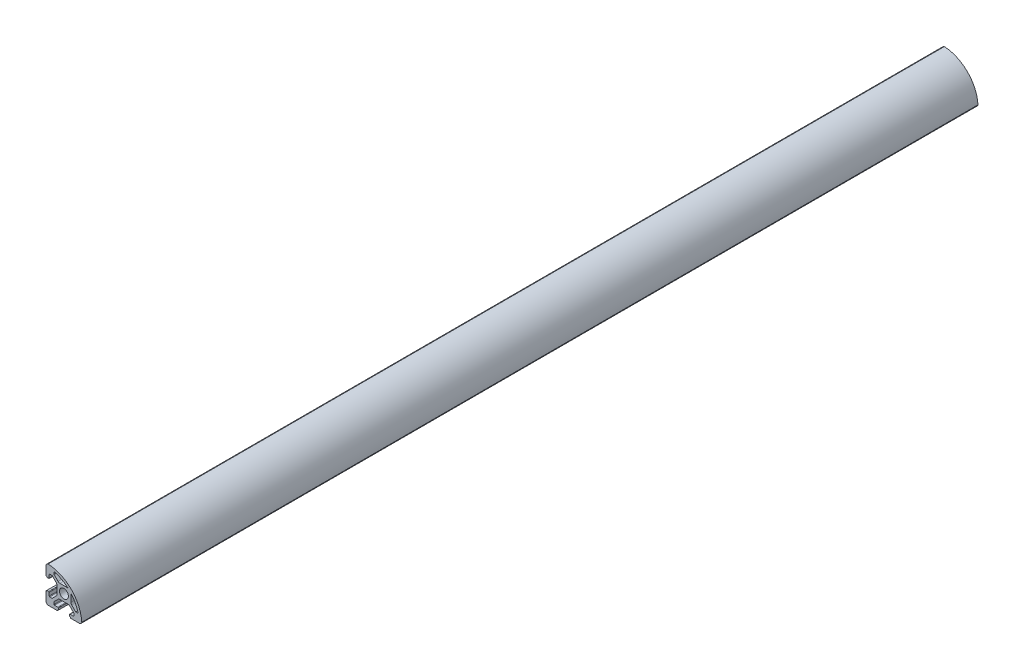
from build123d import *

# Parameters (mm, degrees)
SKETCH_1_R      = 2.5
EXTRUDE_1_DEPTH = 500


with BuildPart() as part:
    # 草图1 → 凸台-拉伸1 (new body)
    with BuildSketch(Plane.XY):
        with BuildLine():
            ThreePointArc((-8.944458369, 9.930115847), (-9.792033903, 9.405190523), (-10.123344197, 8.464890373))
            Line((-10.123344197, 8.464890373), (-10.123344197, 3.564890373))
            Line((-10.123344197, 3.564890373), (-9.823344197, 3.564890373))
            ThreePointArc((-9.823344197, 3.564890373), (-9.681922841, 3.50631173), (-9.623344197, 3.364890373))
            Line((-9.623344197, 3.364890373), (-9.623344197, 3.064890373))
            Line((-9.623344197, 3.064890373), (-8.623344197, 3.064890373))
            ThreePointArc((-8.623344197, 3.064890373), (-8.411212162, 3.152758339), (-8.323344197, 3.364890373))
            Line((-8.323344197, 3.364890373), (-8.323344197, 5.164890373))
            ThreePointArc((-8.323344197, 5.164890373), (-8.235476231, 5.377022408), (-8.023344197, 5.464890373))
            Line((-8.023344197, 5.464890373), (-6.683344197, 5.464890373))
            Line((-6.683344197, 5.464890373), (-4.462684025, 3.244230202))
            ThreePointArc((-4.462684025, 3.244230202), (-4.137524898, 2.757595178), (-4.023344197, 2.18357003))
            Line((-4.023344197, 2.18357003), (-4.023344197, -2.253789283))
            ThreePointArc((-4.023344197, -2.253789283), (-4.137524898, -2.827814432), (-4.462684025, -3.314449455))
            Line((-4.462684025, -3.314449455), (-6.683344197, -5.535109627))
            Line((-6.683344197, -5.535109627), (-8.023344197, -5.535109627))
            ThreePointArc((-8.023344197, -5.535109627), (-8.235476231, -5.447241661), (-8.323344197, -5.235109627))
            Line((-8.323344197, -5.235109627), (-8.323344197, -3.435109627))
            ThreePointArc((-8.323344197, -3.435109627), (-8.411212162, -3.222977592), (-8.623344197, -3.135109627))
            Line((-8.623344197, -3.135109627), (-9.623344197, -3.135109627))
            Line((-9.623344197, -3.135109627), (-9.623344197, -3.435109627))
            ThreePointArc((-9.623344197, -3.435109627), (-9.681922841, -3.576530983), (-9.823344197, -3.635109627))
            Line((-9.823344197, -3.635109627), (-10.123344197, -3.635109627))
            Line((-10.123344197, -3.635109627), (-10.123344197, -8.535109627))
            ThreePointArc((-10.123344197, -8.535109627), (-9.684004369, -9.595769798), (-8.623344197, -10.035109627))
            Line((-8.623344197, -10.035109627), (-3.723344197, -10.035109627))
            Line((-3.723344197, -10.035109627), (-3.723344197, -9.735109627))
            ThreePointArc((-3.723344197, -9.735109627), (-3.664765553, -9.59368827), (-3.523344197, -9.535109627))
            Line((-3.523344197, -9.535109627), (-3.223344197, -9.535109627))
            Line((-3.223344197, -9.535109627), (-3.223344197, -8.535109627))
            ThreePointArc((-3.223344197, -8.535109627), (-3.311212162, -8.322977592), (-3.523344197, -8.235109627))
            Line((-3.523344197, -8.235109627), (-5.323344197, -8.235109627))
            ThreePointArc((-5.323344197, -8.235109627), (-5.535476231, -8.147241661), (-5.623344197, -7.935109627))
            Line((-5.623344197, -7.935109627), (-5.623344197, -6.595109627))
            Line((-5.623344197, -6.595109627), (-3.402684025, -4.374449455))
            ThreePointArc((-3.402684025, -4.374449455), (-2.916049002, -4.049290328), (-2.342023853, -3.935109627))
            Line((-2.342023853, -3.935109627), (2.09533546, -3.935109627))
            ThreePointArc((2.09533546, -3.935109627), (2.669360608, -4.049290328), (3.155995631, -4.374449455))
            Line((3.155995631, -4.374449455), (5.376655803, -6.595109627))
            Line((5.376655803, -6.595109627), (5.376655803, -7.935109627))
            ThreePointArc((5.376655803, -7.935109627), (5.288787838, -8.147241661), (5.076655803, -8.235109627))
            Line((5.076655803, -8.235109627), (3.276655803, -8.235109627))
            ThreePointArc((3.276655803, -8.235109627), (3.064523769, -8.322977592), (2.976655803, -8.535109627))
            Line((2.976655803, -8.535109627), (2.976655803, -9.535109627))
            Line((2.976655803, -9.535109627), (3.276655803, -9.535109627))
            ThreePointArc((3.276655803, -9.535109627), (3.418077159, -9.59368827), (3.476655803, -9.735109627))
            Line((3.476655803, -9.735109627), (3.476655803, -10.035109627))
            Line((3.476655803, -10.035109627), (8.376655803, -10.035109627))
            ThreePointArc((8.376655803, -10.035109627), (9.316955952, -9.703799333), (9.841881277, -8.856223799))
            ThreePointArc((9.841881277, -8.856223799), (4.018791427, 4.107025997), (-8.944458369, 9.930115847))
        make_face()
        with BuildLine():
            ThreePointArc((7.820216628, -5.531930203), (7.798494154, -5.534313715), (7.776655803, -5.535109627))
            Line((7.776655803, -5.535109627), (6.436655803, -5.535109627))
            Line((6.436655803, -5.535109627), (4.215995631, -3.314449455))
            ThreePointArc((4.215995631, -3.314449455), (3.890836504, -2.827814432), (3.776655803, -2.253789283))
            Line((3.776655803, -2.253789283), (3.776655803, 2.173084343))
            ThreePointArc((3.776655803, 2.173084343), (6.257892136, -1.4383023), (7.820216628, -5.531930203))
        make_face(mode=Mode.SUBTRACT)
        with BuildLine():
            ThreePointArc((-5.620164773, 7.908451198), (-1.52653687, 6.346126706), (2.084849773, 3.864890373))
            Line((2.084849773, 3.864890373), (-2.342023853, 3.864890373))
            ThreePointArc((-2.342023853, 3.864890373), (-2.916049002, 3.979071075), (-3.402684025, 4.304230202))
            Line((-3.402684025, 4.304230202), (-5.623344197, 6.524890373))
            Line((-5.623344197, 6.524890373), (-5.623344197, 7.864890373))
            ThreePointArc((-5.623344197, 7.864890373), (-5.622548285, 7.886728724), (-5.620164773, 7.908451198))
        make_face(mode=Mode.SUBTRACT)
        with Locations((-0.123344197, -0.035109627)):
            Circle(SKETCH_1_R, mode=Mode.SUBTRACT)
    extrude(amount=EXTRUDE_1_DEPTH)


solid = part.part
